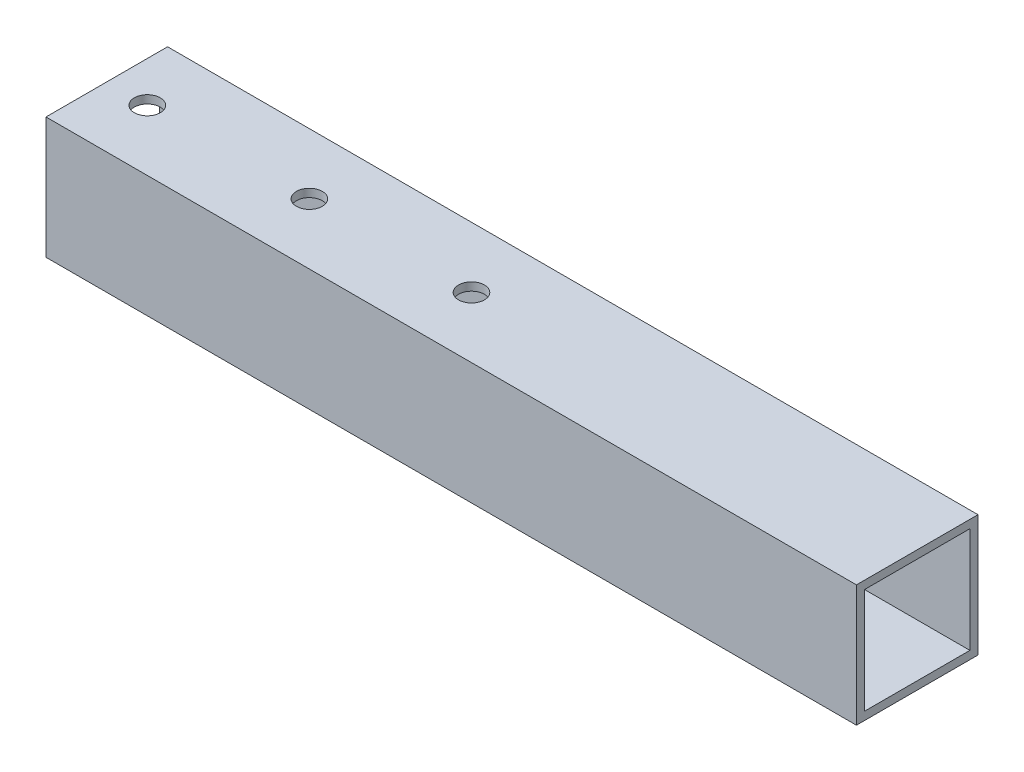
from build123d import *

# Parameters (mm, degrees)
SKETCH_11_W         = 15
SKETCH_11_H         = 15
SKETCH_11_W_2       = 13
SKETCH_11_H_2       = 13
F_15X15X1_1_DEPTH   = 100
SKETCH_12_R         = 1.6
CUT_EXTRUDE_1_DEPTH = 102.396498953


with BuildPart() as part:
    # 草图11 → 铝管 15X15X1(1) (new body)
    with BuildSketch(Plane(origin=(0, 0, 0), x_dir=(0, 0, -1), z_dir=(1, 0, 0))):
        Rectangle(SKETCH_11_W, SKETCH_11_H)
        Rectangle(SKETCH_11_W_2, SKETCH_11_H_2, mode=Mode.SUBTRACT)
    extrude(amount=F_15X15X1_1_DEPTH)

    # 草图12 → 切除-拉伸1 (cut, through all)
    with BuildSketch(Plane(origin=(0, 7.5, 0), x_dir=(1, 0, 0), z_dir=(0, 1, 0))):
        with Locations(Location((45, 0, 0), (0, 0, 270))):
            Circle(SKETCH_12_R)
        with Locations(Location((25, 0, 0), (0, 0, 270))):
            Circle(SKETCH_12_R)
        with Locations(Location((5, 0, 0), (0, 0, 270))):
            Circle(SKETCH_12_R)
    extrude(amount=-CUT_EXTRUDE_1_DEPTH, mode=Mode.SUBTRACT)


solid = part.part
